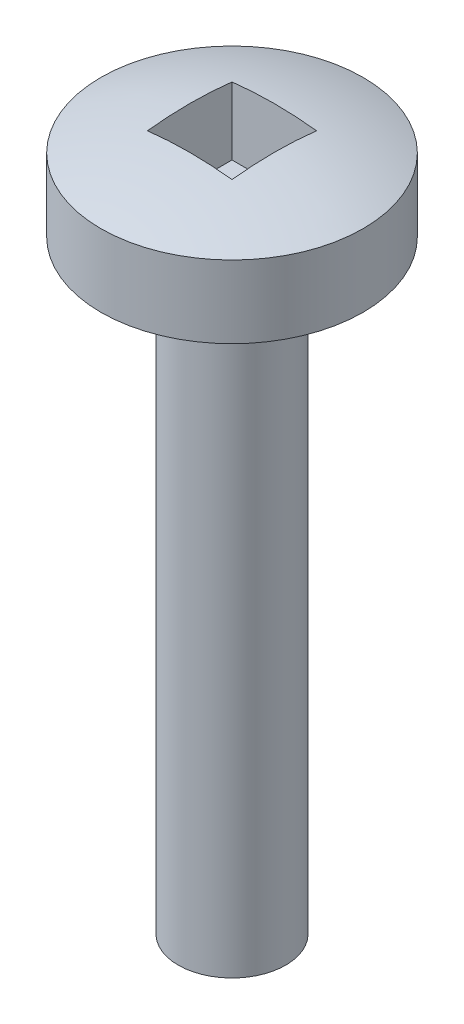
from build123d import *

# Parameters (mm, degrees)
SKETCH1_R            = 1.1303
THREADS_DEPTH        = 12.7
SKETCH2_R            = 2.7559
HEAD_DEPTH           = 1.524
HEADDOME_FACE_RADIUS = 2.7559
HEADDOME_HEIGHT      = 0.508
SKETCH3_W            = 1.778
SKETCH3_H            = 1.778
DRIVER_DEPTH         = 1.524


with BuildPart() as part:
    # Sketch1 → threads (new body)
    with BuildSketch(Plane(origin=(0, 0, 0), x_dir=(1, 0, 0), z_dir=(0, 1, 0))):
        with Locations(Location((0, 0, 0), (0, 0, 270))):
            Circle(SKETCH1_R)
    extrude(amount=-THREADS_DEPTH)

    # Sketch2 → Head (add)
    with BuildSketch(Plane(origin=(0, 0, 0), x_dir=(1, 0, 0), z_dir=(0, 1, 0))):
        with Locations(Location((0, 0, 0), (0, 0, 90))):
            Circle(SKETCH2_R)
    extrude(amount=HEAD_DEPTH)

    # HeadDome: a dome of height H over a round flat face of radius A is a cap of a sphere of radius (A * A + H * H) / (2 * H)
    headdome_r = (HEADDOME_FACE_RADIUS * HEADDOME_FACE_RADIUS + HEADDOME_HEIGHT * HEADDOME_HEIGHT) / (2 * HEADDOME_HEIGHT)
    headdome_base = Plane((0, 1.524, 0), z_dir=(0, 1, 0))
    with Locations(headdome_base.offset(HEADDOME_HEIGHT - headdome_r)):
        headdome_ball = Sphere(headdome_r, mode=Mode.PRIVATE)
    add(split(headdome_ball, bisect_by=headdome_base, keep=Keep.TOP, mode=Mode.PRIVATE))

    # Sketch3 → Driver (cut)
    with BuildSketch(Plane(origin=(0, 2.032, 0), x_dir=(1, 0, 0), z_dir=(0, 1, 0))):
        Rectangle(SKETCH3_W, SKETCH3_H)
    extrude(amount=-DRIVER_DEPTH, mode=Mode.SUBTRACT)


solid = part.part
